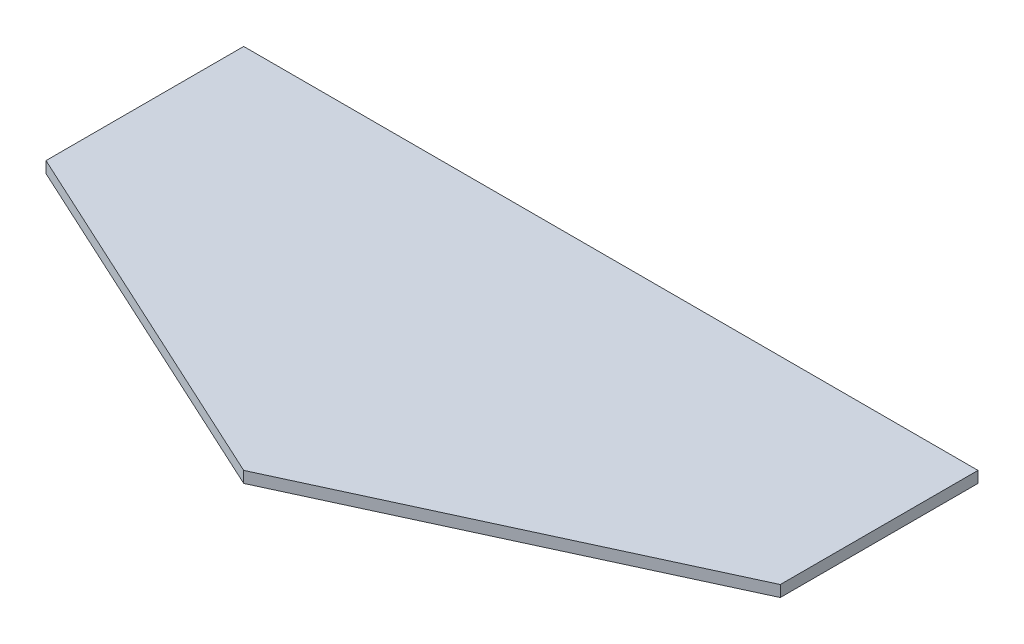
from build123d import *

# Parameters (mm, degrees)
SKETCH1_W           = 260
SKETCH1_H           = 70
BOSS_EXTRUDE1_DEPTH = 4


with BuildPart() as part:
    # Sketch1 → Boss-Extrude1 (new body)
    with BuildSketch(Plane(origin=(0, 0, 0), x_dir=(1, 0, 0), z_dir=(0, 1, 0))):
        Polygon((130, -70), (0, -70), (130, -130), align=None)
        with Locations((130, -35)):
            Rectangle(SKETCH1_W, SKETCH1_H)
        Polygon((130, -70), (130, -130), (260, -70), align=None)
    extrude(amount=BOSS_EXTRUDE1_DEPTH)


solid = part.part
